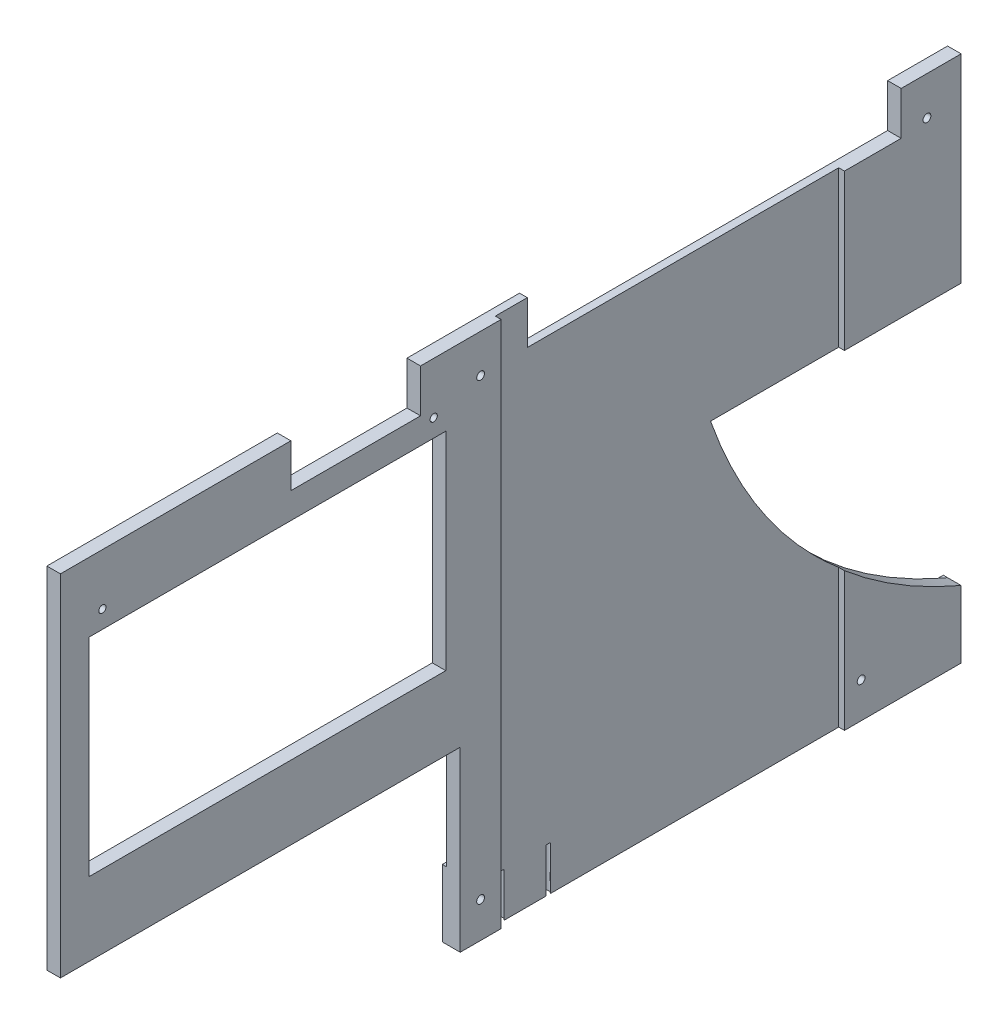
from build123d import *

# Parameters (mm, degrees)
SKETCH1_W                     = 312.66
SKETCH1_H                     = 183.16
BODY_DEPTH                    = 4.7
F_6_32_TAPPED_HOLE1_D         = 2.7051
RISER_CABLE_CUTOUT_REACH      = 364.389
EXPANSION_CUTOUT_REACH        = 364.389
SKETCH11_W                    = 138.78
SKETCH11_H                    = 61.66
PSU_CABLE_CUTOUT_REACH        = 364.389
SKETCH20_W                    = 45
SKETCH20_H                    = 15
SSD_ACCESS_CUTOUT_REACH       = 364.389
SKETCH22_W                    = 123.78
SKETCH22_H                    = 72
TAP_DRILL_FOR_M3X0_5_TAP1_D   = 2.5
HOLE_IN_STOCK_REACH           = 364.389
SKETCH33_W                    = 173.88
SKETCH33_H                    = 23.33
BOSS_EXTRUDE1_DEPTH           = 1.5
TAP_DRILL_FOR_6_32_TAP1_D     = 2.7051
TAP_DRILL_FOR_6_32_TAP1_DEPTH = 15.24
TAP_DRILL_FOR_6_32_TAP1_TIP   = 0.81269403
SKETCH32_W                    = 119.186565276
SKETCH32_H                    = 183.16
CUT_EXTRUDE1_DEPTH            = 2


with BuildPart() as part:
    # Sketch1 → body (new body)
    with BuildSketch(Plane(origin=(0, 0, 0), x_dir=(0, 0, -1), z_dir=(1, 0, 0))):
        with Locations((-156.33, 91.58)):
            Rectangle(SKETCH1_W, SKETCH1_H)
    extrude(amount=BODY_DEPTH)

    # #6-32 Tapped Hole1 (through all)
    with Locations(Plane(origin=(4.7, 169.81, 166.8), x_dir=(0, 0, 1), z_dir=(1, 0, 0))):
        with Locations((0, 0), (-154.94, 0), (-132.08, 157.48), (0, 157.48)):
            Hole(F_6_32_TAPPED_HOLE1_D / 2)

    # Sketch8 → riser-cable-cutout (cut, up to next)
    with BuildSketch(Plane(origin=(4.7, 0, 0), x_dir=(0, 0, -1), z_dir=(1, 0, 0)), mode=Mode.PRIVATE) as riser_cable_cutout_sk1:
        Polygon((-148.58070669, 183.16), (-20.810027071, 183.16), (-20.810027071, 176.16), (-20.810027071, 168.16), (-148.58070669, 168.16), (-148.58070669, 176.16), align=None)
    riser_cable_cutout_tool1 = extrude(riser_cable_cutout_sk1.sketch, amount=-RISER_CABLE_CUTOUT_REACH, mode=Mode.PRIVATE) & part.part
    add(riser_cable_cutout_tool1.solids().sort_by_distance((4.7, 175.66, 84.695367))[0], mode=Mode.SUBTRACT)

    # Sketch11 → expansion-cutout (cut, up to next)
    with BuildSketch(Plane(origin=(4.7, 0, 0), x_dir=(0, 0, -1), z_dir=(1, 0, 0)), mode=Mode.PRIVATE) as expansion_cutout_sk1:
        with Locations((-243.27, 30.83)):
            Rectangle(SKETCH11_W, SKETCH11_H)
    expansion_cutout_tool1 = extrude(expansion_cutout_sk1.sketch, amount=-EXPANSION_CUTOUT_REACH, mode=Mode.PRIVATE) & part.part
    add(expansion_cutout_tool1.solids().sort_by_distance((4.7, 30.83, 243.27))[0], mode=Mode.SUBTRACT)

    # Sketch20 → psu-cable-cutout (cut, up to next)
    with BuildSketch(Plane(origin=(4.7, 0, 0), x_dir=(0, 0, -1), z_dir=(1, 0, 0)), mode=Mode.PRIVATE) as psu_cable_cutout_sk1:
        with Locations((-210.16, 175.66)):
            Rectangle(SKETCH20_W, SKETCH20_H)
    psu_cable_cutout_tool1 = extrude(psu_cable_cutout_sk1.sketch, amount=-PSU_CABLE_CUTOUT_REACH, mode=Mode.PRIVATE) & part.part
    add(psu_cable_cutout_tool1.solids().sort_by_distance((4.7, 175.66, 210.16))[0], mode=Mode.SUBTRACT)

    # Sketch22 → ssd-access-cutout (cut, up to next)
    with BuildSketch(Plane(origin=(4.7, 0, 0), x_dir=(0, 0, -1), z_dir=(1, 0, 0)), mode=Mode.PRIVATE) as ssd_access_cutout_sk1:
        with Locations((-240.77, 123.16)):
            Rectangle(SKETCH22_W, SKETCH22_H)
    ssd_access_cutout_tool1 = extrude(ssd_access_cutout_sk1.sketch, amount=-SSD_ACCESS_CUTOUT_REACH, mode=Mode.PRIVATE) & part.part
    add(ssd_access_cutout_tool1.solids().sort_by_distance((4.7, 123.16, 240.77))[0], mode=Mode.SUBTRACT)

    # Tap Drill for M3x0.5 Tap1 (through all)
    with Locations(Plane(origin=(4.7, 0, 0), x_dir=(0, 0, -1), z_dir=(1, 0, 0))):
        with Locations((-298.08, 165.31), (-183.08, 165.31)):
            Hole(TAP_DRILL_FOR_M3X0_5_TAP1_D / 2)

    # Sketch27 → hole-in-stock (cut, up to next)
    with BuildSketch(Plane(origin=(4.7, 0, 0), x_dir=(0, 0, -1), z_dir=(1, 0, 0)), mode=Mode.PRIVATE) as hole_in_stock_sk1:
        with BuildLine():
            Line((0, 114.21), (-84.98, 114.21))
            add(Edge.make_bspline(
                [(-84.98, 114.21), (-62.176533149, 49.839292815), (0, 23.33)],
                knots=[0, 0, 0, 1, 1, 1], degree=2))
            Line((0, 23.33), (0, 114.21))
        make_face()
    hole_in_stock_tool1 = extrude(hole_in_stock_sk1.sketch, amount=-HOLE_IN_STOCK_REACH, mode=Mode.PRIVATE) & part.part
    add(hole_in_stock_tool1.solids().sort_by_distance((4.7, 79.62289, 32.431716))[0], mode=Mode.SUBTRACT)

    # Sketch33 → Boss-Extrude1 (add)
    with BuildSketch(Plane.ZY):
        with Locations((86.94, 11.665)):
            Rectangle(SKETCH33_W, SKETCH33_H)
    extrude(amount=BOSS_EXTRUDE1_DEPTH)

    # Tap Drill for #6-32 Tap1
    with Locations(Plane(origin=(0, 0, 0), x_dir=(-1, 0, 0), z_dir=(0, -1, 0))):
        with Locations((-1.6, -157.446313124), (-1.6, -141.386526913)):
            Hole(TAP_DRILL_FOR_6_32_TAP1_D / 2, depth=TAP_DRILL_FOR_6_32_TAP1_DEPTH)
            with Locations((0, 0, -(TAP_DRILL_FOR_6_32_TAP1_DEPTH + TAP_DRILL_FOR_6_32_TAP1_TIP / 2))):  # 118° drill point
                Cone(0, TAP_DRILL_FOR_6_32_TAP1_D / 2, TAP_DRILL_FOR_6_32_TAP1_TIP, mode=Mode.SUBTRACT)

    # Sketch32 → Cut-Extrude1 (cut)
    with BuildSketch(Plane(origin=(4.7, 0, 0), x_dir=(0, 0, -1), z_dir=(1, 0, 0))):
        with Locations((-100.09076437, 91.58)):
            Rectangle(SKETCH32_W, SKETCH32_H)
    extrude(amount=-CUT_EXTRUDE1_DEPTH, mode=Mode.SUBTRACT)


solid = part.part
